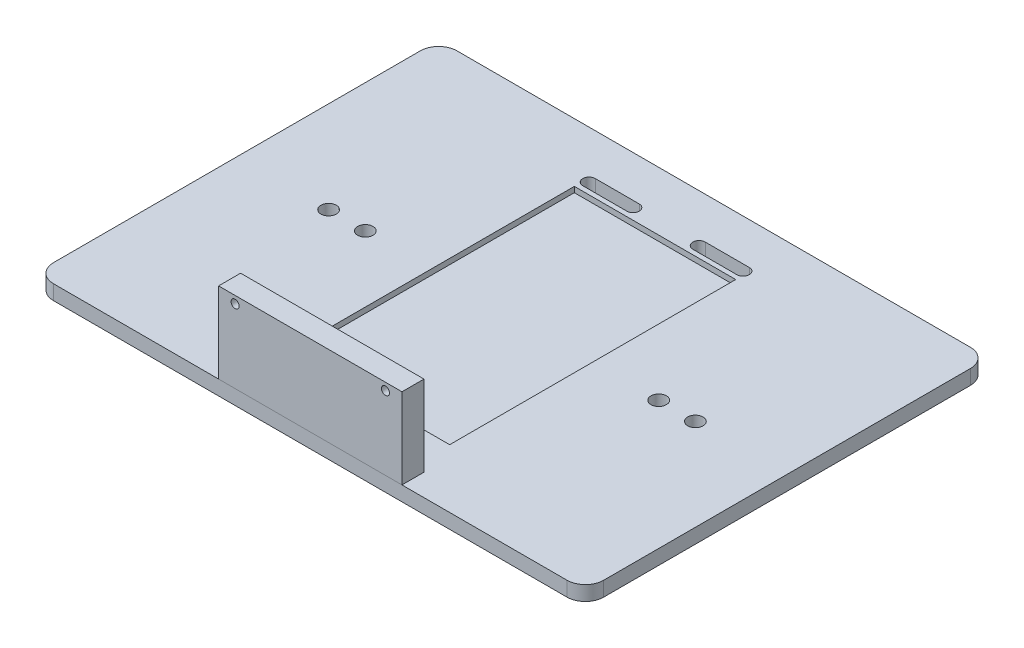
from build123d import *

# Parameters (mm, degrees)
SKETCH1_W           = 150
SKETCH1_H           = 110
BOSS_EXTRUDE1_DEPTH = 4
FILLET1_R           = 5
SKETCH2_R           = 2.1
CUT_EXTRUDE1_DEPTH  = 94.091352982
SKETCH3_R           = 3
BOSS_EXTRUDE2_DEPTH = 2
CUT_EXTRUDE2_DEPTH  = 1.5
SKETCH7_W           = 50
SKETCH7_H           = 22
BOSS_EXTRUDE4_DEPTH = 6
SKETCH8_R           = 1.1
CUT_EXTRUDE3_DEPTH  = 131.831953284
CUT_EXTRUDE4_DEPTH  = 97.571217244


with BuildPart() as part:
    # Sketch1 → Boss-Extrude1 (new body)
    with BuildSketch(Plane(origin=(0, 0, 0), x_dir=(1, 0, 0), z_dir=(0, 1, 0))):
        Rectangle(SKETCH1_W, SKETCH1_H)
    extrude(amount=BOSS_EXTRUDE1_DEPTH)

    # Fillet1
    fillet1_edges = [part.edges().sort_by_distance(p)[0] for p in [
        (75, 2, 55),
        (-75, 2, 55),
        (-75, 2, -55),
        (75, 2, -55),
    ]]
    fillet(fillet1_edges, radius=FILLET1_R)

    # Sketch2 → Cut-Extrude1 (cut, through all)
    with BuildSketch(Plane(origin=(0, 4, 0), x_dir=(1, 0, 0), z_dir=(0, 1, 0))):
        with Locations(Location((-50, 0, 0), (0, 0, 270))):
            Circle(SKETCH2_R)
        with Locations(Location((-40, 0, 0), (0, 0, 270))):
            Circle(SKETCH2_R)
    cut_extrude1 = extrude(amount=-CUT_EXTRUDE1_DEPTH, mode=Mode.SUBTRACT)

    # Sketch3 → Boss-Extrude2 (add)
    with BuildSketch(Plane.XZ):
        with Locations(Location((-50, 0, 0), (0, 0, 270))):
            Circle(SKETCH3_R)
        with Locations(Location((-40, 0, 0), (0, 0, 270))):
            Circle(SKETCH3_R)
    boss_extrude2 = extrude(amount=BOSS_EXTRUDE2_DEPTH)

    # Mirror1: Cut-Extrude1, Boss-Extrude2 across plane
    add(cut_extrude1.mirror(Plane(origin=(0, 0, 0), x_dir=(0, 0, 1), z_dir=(1, 0, 0))), mode=Mode.SUBTRACT)
    add(boss_extrude2.mirror(Plane(origin=(0, 0, 0), x_dir=(0, 0, 1), z_dir=(1, 0, 0))))

    # Sketch4 → Cut-Extrude2 (cut)
    with BuildSketch(Plane(origin=(0, 4, 0), x_dir=(1, 0, 0), z_dir=(0, 1, 0))):
        Polygon((-22, -39), (-6, -39), (-6, -43), (6, -43), (6, -39), (22, -39), (22, 39), (-22, 39), align=None)
    extrude(amount=-CUT_EXTRUDE2_DEPTH, mode=Mode.SUBTRACT)

    # Sketch9 → Cut-Extrude4 (cut, through all)
    with BuildSketch(Plane.XZ):
        with BuildLine():
            Line((-21, -40.3), (-9, -40.3))
            ThreePointArc((-9, -40.3), (-7.3, -42), (-9, -43.7))
            Line((-9, -43.7), (-21, -43.7))
            ThreePointArc((-21, -43.7), (-22.7, -42), (-21, -40.3))
        make_face()
        with BuildLine():
            Line((21, -40.3), (9, -40.3))
            ThreePointArc((9, -40.3), (7.3, -42), (9, -43.7))
            Line((9, -43.7), (21, -43.7))
            ThreePointArc((21, -43.7), (22.7, -42), (21, -40.3))
        make_face()
    extrude(amount=-CUT_EXTRUDE4_DEPTH, mode=Mode.SUBTRACT)


with BuildPart() as body_2:
    # Sketch7 → Boss-Extrude4 (new body)
    with BuildSketch(Plane.XY.offset(55)):
        with Locations((0, 15)):
            Rectangle(SKETCH7_W, SKETCH7_H)
    extrude(amount=-BOSS_EXTRUDE4_DEPTH)

    # Sketch8 → Cut-Extrude3 (cut, through all)
    with BuildSketch(Plane(origin=(0, 0, 49), x_dir=(-1, 0, 0), z_dir=(0, 0, -1))):
        with Locations((-20.5, 24)):
            Circle(SKETCH8_R)
        with Locations(Location((20.5, 24, 0), (0, 0, 180))):
            Circle(SKETCH8_R)
    extrude(amount=-CUT_EXTRUDE3_DEPTH, mode=Mode.SUBTRACT)


solid = Compound([part.part, body_2.part])
